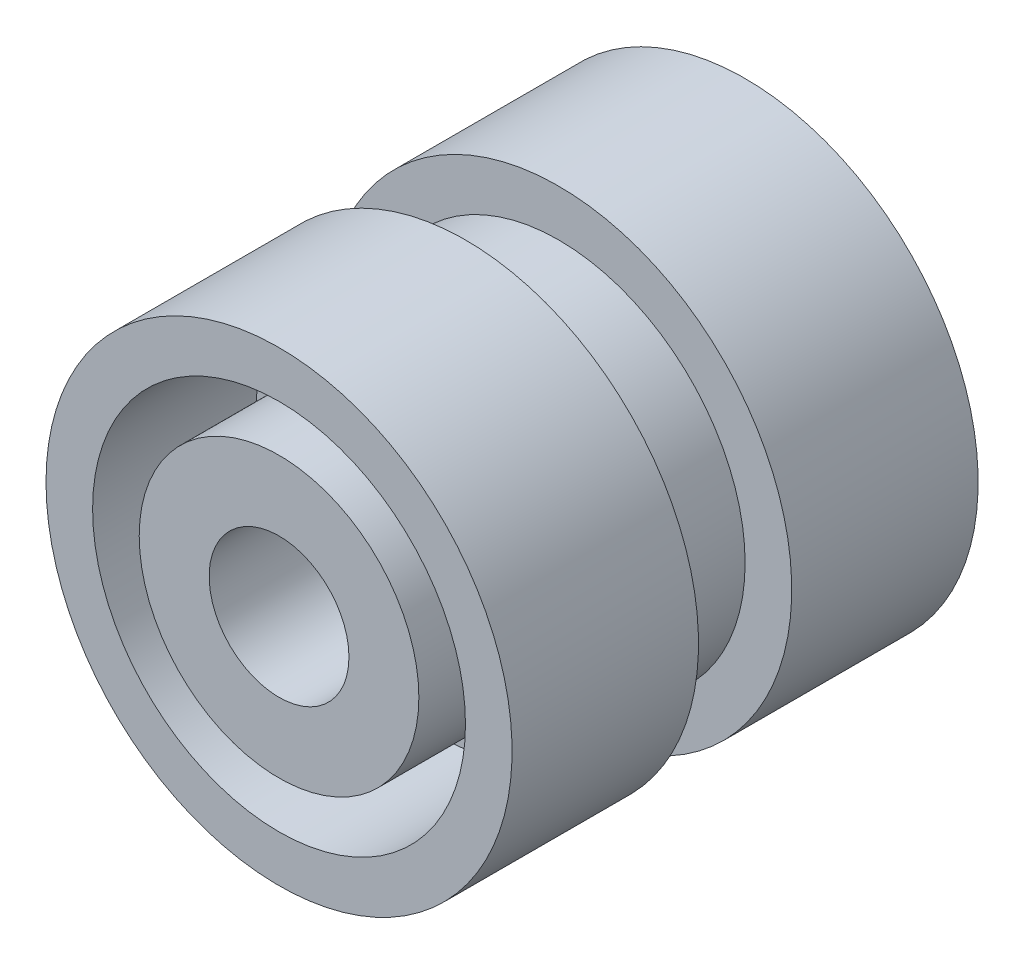
from build123d import *

# Parameters (mm, degrees)
BOSS_EXTRUDE1_DEPTH = 2
SKETCH4_R           = 1.5
CUT_EXTRUDE1_DEPTH  = 8


with BuildPart() as part:
    # Sketch2 → Revolve1 (revolve)
    with BuildSketch(Plane(origin=(0, 0, 0), x_dir=(0, 0, -1), z_dir=(1, 0, 0)), mode=Mode.PRIVATE) as revolve1_sk:
        Polygon((0, 0), (-5, 0), (-5, 3), (-1.5, 3), (-1.5, 4), (-5, 4), (-5, 5), (-1, 5), (-1, 4), (1, 4), (1, 5), (5, 5), (5, 4), (1.5, 4), (1.5, 0), align=None)
    revolve(revolve1_sk.sketch.rotate(Axis((0, 0, 0), (0, 0, 1)), 90), axis=Axis((0, 0, 0), (0, 0, 1)))

    # Sketch3 → Boss-Extrude1 (add)
    with BuildSketch(Plane(origin=(0, 0, -1.5), x_dir=(-1, 0, 0), z_dir=(0, 0, -1))):
        with BuildLine():
            ThreePointArc((1.936491673, 0.5), (1.414213562, 1.414213562), (0.5, 1.936491673))
            Line((0.5, 1.936491673), (0.5, 3.968626967))
            ThreePointArc((0.5, 3.968626967), (0, 4), (-0.5, 3.968626967))
            Line((-0.5, 3.968626967), (-0.5, 1.936491673))
            ThreePointArc((-0.5, 1.936491673), (-1.414213562, 1.414213562), (-1.936491673, 0.5))
            Line((-1.936491673, 0.5), (-3.968626967, 0.5))
            ThreePointArc((-3.968626967, 0.5), (-4, 0), (-3.968626967, -0.5))
            Line((-3.968626967, -0.5), (-1.936491673, -0.5))
            ThreePointArc((-1.936491673, -0.5), (-1.414213562, -1.414213562), (-0.5, -1.936491673))
            Line((-0.5, -1.936491673), (-0.5, -3.968626967))
            ThreePointArc((-0.5, -3.968626967), (0, -4), (0.5, -3.968626967))
            Line((0.5, -3.968626967), (0.5, -1.936491673))
            ThreePointArc((0.5, -1.936491673), (1.414213562, -1.414213562), (1.936491673, -0.5))
            Line((1.936491673, -0.5), (3.968626967, -0.5))
            ThreePointArc((3.968626967, -0.5), (3.992149037, -0.25049165), (4, 0))
            ThreePointArc((4, 0), (3.992149037, 0.25049165), (3.968626967, 0.5))
            Line((3.968626967, 0.5), (1.936491673, 0.5))
        make_face()
    extrude(amount=BOSS_EXTRUDE1_DEPTH)

    # Sketch4 → Cut-Extrude1 (cut)
    with BuildSketch(Plane.XY.offset(5)):
        Circle(SKETCH4_R)
    extrude(amount=-CUT_EXTRUDE1_DEPTH, mode=Mode.SUBTRACT)


solid = part.part
